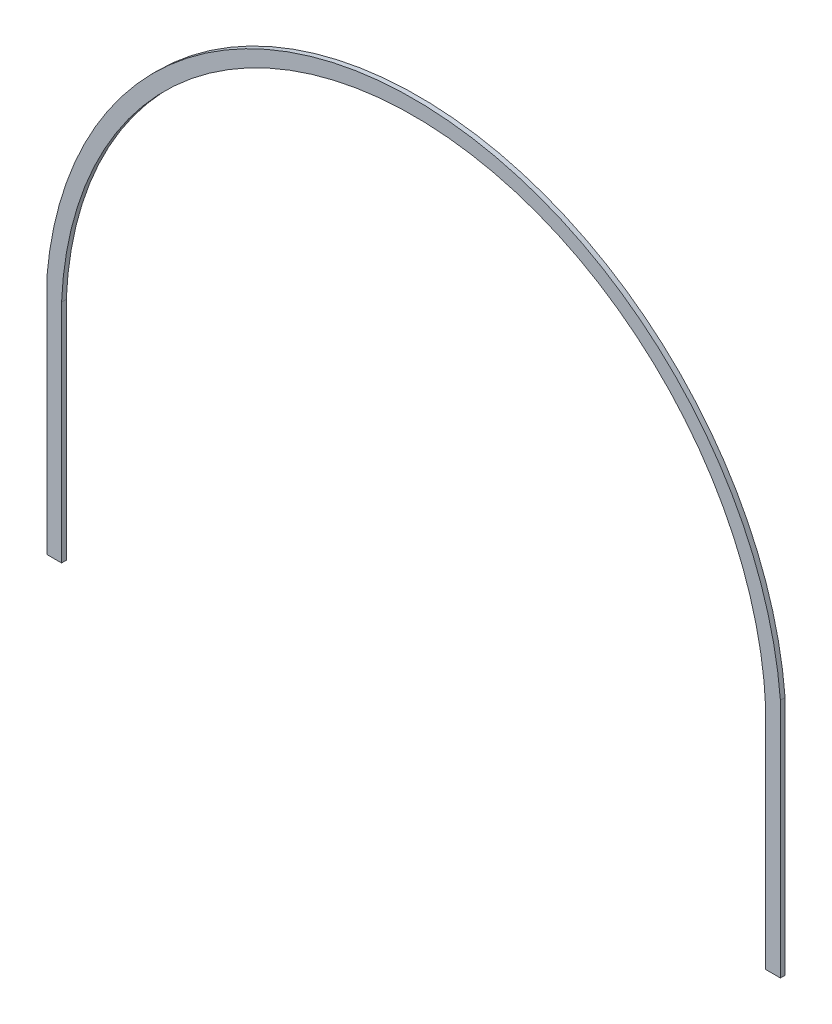
from build123d import *

# Parameters (mm, degrees)
BOSS_EXTRU_1_DEPTH = 1.6


with BuildPart() as part:
    # Esquisse1 → Boss.-Extru.1 (new body)
    with BuildSketch(Plane.XY):
        with BuildLine():
            Line((5, 0), (5, 77))
            ThreePointArc((5, 77), (125, 192), (245, 77))
            Line((245, 77), (245, 0))
            Line((245, 0), (250, 0))
            Line((250, 0), (250, 82))
            ThreePointArc((250, 82), (125, 197), (0, 82))
            Line((0, 82), (0, 0))
            Line((0, 0), (5, 0))
        make_face()
    extrude(amount=BOSS_EXTRU_1_DEPTH)


solid = part.part
